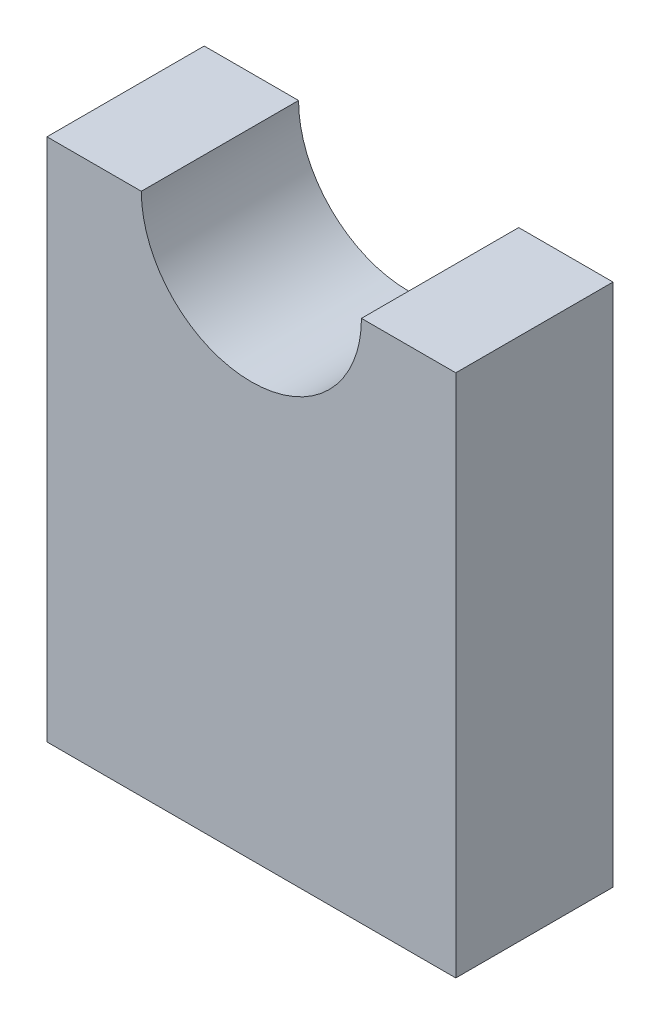
from build123d import *

# Parameters (mm, degrees)
EXTRUDE_1_DEPTH = 30


with BuildPart() as part:
    # 草图1 → 拉伸1 (new body)
    with BuildSketch(Plane.XY):
        with BuildLine():
            Line((0, 0), (78, 0))
            Line((78, 0), (78, 100))
            Line((78, 100), (60, 100))
            ThreePointArc((60, 100), (39, 79), (18, 100))
            Line((18, 100), (0, 100))
            Line((0, 100), (0, 0))
        make_face()
    extrude(amount=EXTRUDE_1_DEPTH)


solid = part.part
